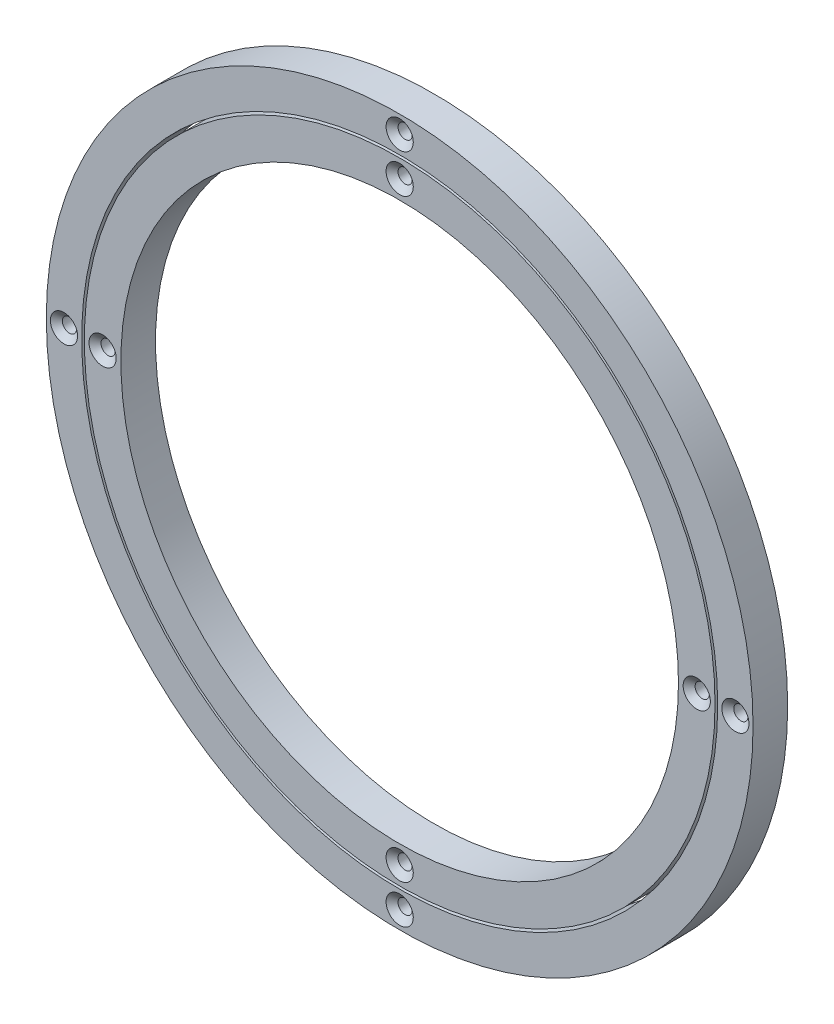
from build123d import *

# Parameters (mm, degrees)
SKETCH1_R                                     = 113.3348
SKETCH1_R_2                                   = 100.203
BOSS_EXTRUDE1_DEPTH                           = 12.446
SKETCH1_R_3                                   = 127
SKETCH1_R_4                                   = 114.3
BOSS_EXTRUDE1_2_DEPTH                         = 12.446
CSK_FOR_10_FLAT_HEAD_MACHINE_SCREW_2_COUNT    = 2
CSK_FOR_10_FLAT_HEAD_MACHINE_SCREW_2_PITCH    = 170.6248663
CSK_FOR_10_FLAT_HEAD_MACHINE_SCREW_3_COUNT    = 2
CSK_FOR_10_FLAT_HEAD_MACHINE_SCREW_3_PITCH    = 241.3
CSK_FOR_10_FLAT_HEAD_MACHINE_SCREW_4_COUNT    = 2
CSK_FOR_10_FLAT_HEAD_MACHINE_SCREW_4_PITCH    = 170.6248663
CSK_FOR_10_FLAT_HEAD_MACHINE_SCREW_5_AT_COUNT = 2
CSK_FOR_10_FLAT_HEAD_MACHINE_SCREW_5_AT_PITCH = 150.99402642
CSK_FOR_10_FLAT_HEAD_MACHINE_SCREW_6_COUNT    = 2
CSK_FOR_10_FLAT_HEAD_MACHINE_SCREW_6_PITCH    = 213.5378
CSK_FOR_10_FLAT_HEAD_MACHINE_SCREW_7_COUNT    = 2
CSK_FOR_10_FLAT_HEAD_MACHINE_SCREW_7_PITCH    = 150.99402642


with BuildPart() as part:
    # Sketch1 → Boss-Extrude1 (new body)
    with BuildSketch(Plane.XY):
        Circle(SKETCH1_R)
        Circle(SKETCH1_R_2, mode=Mode.SUBTRACT)
    extrude(amount=BOSS_EXTRUDE1_DEPTH)

    # Sketch15 → CSK for _10 Flat Head Machine Screw  5 (revolve, cut)
    with BuildSketch(Plane(origin=(0, -106.7689, 12.446), x_dir=(0, -1, 0), z_dir=(1, 0, 0))):
        Polygon((0, 0), (0, 12.446), (2.5527, 12.446), (2.5527, 1.960808018), (4.8895, 0), align=None)
    csk_for_10_flat_head_machine_screw_5 = revolve(axis=Axis((0, -106.7689, 18.796), (0, 0, -1)), mode=Mode.SUBTRACT)

    # CSK for _10 Flat Head Machine Screw 5 at: CSK for _10 Flat Head Machine Screw  5 ×2
    with Locations(*[Vector(-0.7071067811865476, 0.7071067811865476, 0) * (i * CSK_FOR_10_FLAT_HEAD_MACHINE_SCREW_5_AT_PITCH) for i in range(1, CSK_FOR_10_FLAT_HEAD_MACHINE_SCREW_5_AT_COUNT)]):
        add(csk_for_10_flat_head_machine_screw_5, mode=Mode.SUBTRACT)

    # CSK for _10 Flat Head Machine Screw  6: CSK for _10 Flat Head Machine Screw  5 ×2
    with Locations(*[(0, i * CSK_FOR_10_FLAT_HEAD_MACHINE_SCREW_6_PITCH, 0) for i in range(1, CSK_FOR_10_FLAT_HEAD_MACHINE_SCREW_6_COUNT)]):
        add(csk_for_10_flat_head_machine_screw_5, mode=Mode.SUBTRACT)

    # CSK for _10 Flat Head Machine Screw  7: CSK for _10 Flat Head Machine Screw  5 ×2
    with Locations(*[Vector(0.7071067811865476, 0.7071067811865476, 0) * (i * CSK_FOR_10_FLAT_HEAD_MACHINE_SCREW_7_PITCH) for i in range(1, CSK_FOR_10_FLAT_HEAD_MACHINE_SCREW_7_COUNT)]):
        add(csk_for_10_flat_head_machine_screw_5, mode=Mode.SUBTRACT)


with BuildPart() as body_2:
    # Sketch1 → Boss-Extrude1 2 (new body)
    with BuildSketch(Plane.XY):
        Circle(SKETCH1_R_3)
        Circle(SKETCH1_R_4, mode=Mode.SUBTRACT)
    extrude(amount=BOSS_EXTRUDE1_2_DEPTH)

    # Sketch11 → CSK for _10 Flat Head Machine Screw _100 (revolve, cut)
    with BuildSketch(Plane(origin=(0, -120.65, 12.446), x_dir=(0, -1, 0), z_dir=(1, 0, 0))):
        Polygon((0, 0), (0, 12.446), (2.5527, 12.446), (2.5527, 1.960808018), (4.8895, 0), align=None)
    csk_for_10_flat_head_machine_screw_100 = revolve(axis=Axis((0, -120.65, 18.796), (0, 0, -1)), mode=Mode.SUBTRACT)

    # CSK for _10 Flat Head Machine Screw  2: CSK for _10 Flat Head Machine Screw _100 ×2
    with Locations(*[Vector(-0.7071067811865476, 0.7071067811865476, 0) * (i * CSK_FOR_10_FLAT_HEAD_MACHINE_SCREW_2_PITCH) for i in range(1, CSK_FOR_10_FLAT_HEAD_MACHINE_SCREW_2_COUNT)]):
        add(csk_for_10_flat_head_machine_screw_100, mode=Mode.SUBTRACT)

    # CSK for _10 Flat Head Machine Screw  3: CSK for _10 Flat Head Machine Screw _100 ×2
    with Locations(*[(0, i * CSK_FOR_10_FLAT_HEAD_MACHINE_SCREW_3_PITCH, 0) for i in range(1, CSK_FOR_10_FLAT_HEAD_MACHINE_SCREW_3_COUNT)]):
        add(csk_for_10_flat_head_machine_screw_100, mode=Mode.SUBTRACT)

    # CSK for _10 Flat Head Machine Screw  4: CSK for _10 Flat Head Machine Screw _100 ×2
    with Locations(*[Vector(0.7071067811865476, 0.7071067811865476, 0) * (i * CSK_FOR_10_FLAT_HEAD_MACHINE_SCREW_4_PITCH) for i in range(1, CSK_FOR_10_FLAT_HEAD_MACHINE_SCREW_4_COUNT)]):
        add(csk_for_10_flat_head_machine_screw_100, mode=Mode.SUBTRACT)


solid = Compound([part.part, body_2.part])
